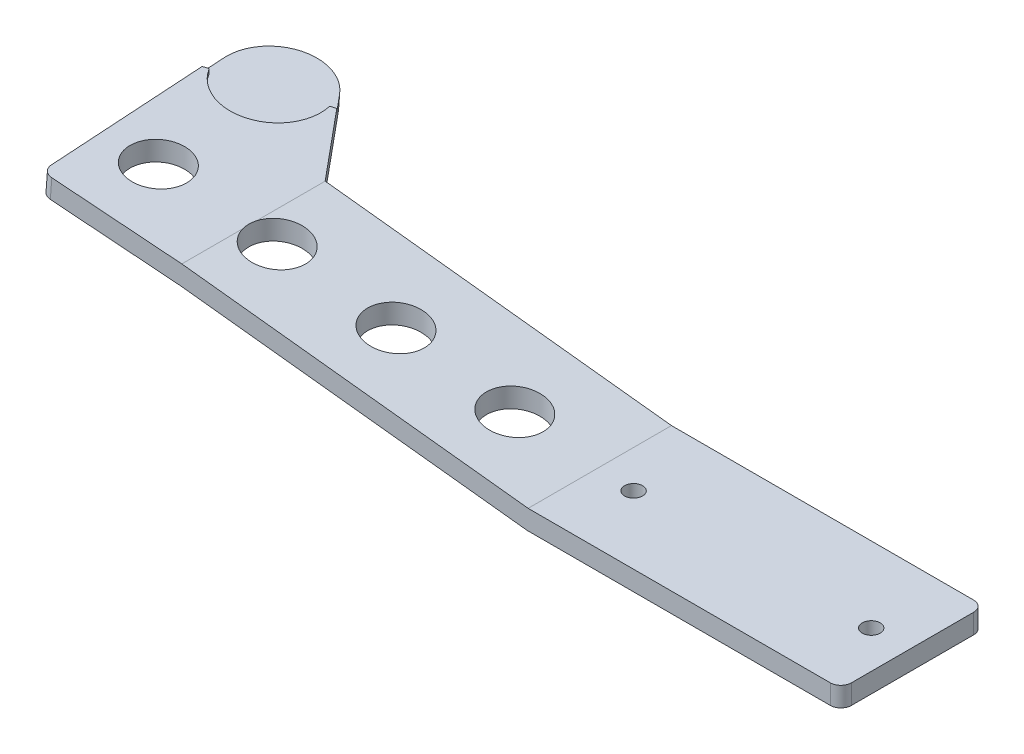
from build123d import *

# Parameters (mm, degrees)
BOSS_EXTRUDE1_DEPTH     = 24.13
CUT_EXTRUDE1_DEPTH      = 140.018460965
CUT_EXTRUDE1_DEPTH_BACK = 140.018460965
SKETCH2_R               = 1.5113
SKETCH2_R_2             = 4.7625
BOSS_EXTRUDE2_DEPTH     = 3.302
CUT_EXTRUDE2_DEPTH      = 140.247845391
CUT_EXTRUDE2_DEPTH_BACK = 140.247845391
FILLET1_R               = 1.778
CUT_EXTRUDE3_DEPTH      = 0.889


with BuildPart() as part:
    # Sketch1 → Boss-Extrude1 (new body)
    with BuildSketch(Plane.XY):
        Polygon((0, 0), (-52.832, 0), (-111.252, 6.498782895), (-136.652, 8.382), (-136.407851909, 11.674961541), (-110.947287613, 9.787254053), (-52.648903452, 3.302), (0, 3.302), align=None)
    extrude(amount=BOSS_EXTRUDE1_DEPTH)

    # Sketch2 → Cut-Extrude1 (cut, two sides: drawn at the far end of the back side and taken through both)
    with BuildSketch(Plane(origin=(0, 3.302, 0), x_dir=(1, 0, 0), z_dir=(0, 1, 0)).offset(-CUT_EXTRUDE1_DEPTH_BACK)):
        with Locations(Location((-6.324451726, -12.7, 0), (0, 0, 180))):
            Circle(SKETCH2_R)
        with Locations(Location((-46.324451726, -12.7, 0), (0, 0, 180))):
            Circle(SKETCH2_R)
        with Locations(Location((-66.324451726, -12.7, 0), (0, 0, 180))):
            Circle(SKETCH2_R_2)
        with Locations(Location((-86.324451726, -12.7, 0), (0, 0, 180))):
            Circle(SKETCH2_R_2)
        with Locations(Location((-106.324451726, -12.7, 0), (0, 0, 180))):
            Circle(SKETCH2_R_2)
        with Locations(Location((-126.324451726, -12.7, 0), (0, 0, 180))):
            Circle(SKETCH2_R_2)
    extrude(amount=CUT_EXTRUDE1_DEPTH + CUT_EXTRUDE1_DEPTH_BACK, mode=Mode.SUBTRACT)

    # Sketch3 → Boss-Extrude2 (add)
    with BuildSketch(Plane(origin=(0.115129755, 1.552819246, 0), x_dir=(0.9972627319520296, -0.07393945806924965, 0), z_dir=(0.07393945806924965, 0.9972627319520296, 0))):
        with BuildLine():
            Line((-136.897707384, 0), (-136.897707384, 8.89))
            ThreePointArc((-136.897707384, 8.89), (-131.63888491, 16.361853382), (-122.830660339, 13.933070421))
            Line((-122.830660339, 13.933070421), (-111.367259408, 0))
            Line((-111.367259408, 0), (-136.897707384, 0))
        make_face()
    extrude(amount=-BOSS_EXTRUDE2_DEPTH)

    # Sketch4 → Cut-Extrude2 (cut, two sides: drawn at the far end of the back side and taken through both)
    with BuildSketch(Plane(origin=(0.115129755, 1.552819246, 0), x_dir=(0.9972627319520296, -0.07393945806924965, 0), z_dir=(0.07393945806924965, 0.9972627319520296, 0)).offset(-CUT_EXTRUDE2_DEPTH_BACK)):
        Polygon((-136.897707384, 8.89), (-134.992707384, -24.13), (-136.897707384, -24.13), (-138.802707384, -24.13), (-138.802707384, 8.89), align=None)
    extrude(amount=CUT_EXTRUDE2_DEPTH + CUT_EXTRUDE2_DEPTH_BACK, mode=Mode.SUBTRACT)

    # Fillet1
    fillet1_edges = [part.edges().sort_by_distance(p)[0] for p in [
        (0, 1.651, 0),
        (0, 1.651, 24.13),
        (-134.63014045, 9.887626103, 24.13),
    ]]
    fillet(fillet1_edges, radius=FILLET1_R)

    # Sketch5 → Cut-Extrude3 (cut)
    with BuildSketch(Plane(origin=(0.115129755, 1.552819246, 0), x_dir=(0.9972627319520296, -0.07393945806924965, 0), z_dir=(0.07393945806924965, 0.9972627319520296, 0))):
        with BuildLine():
            Line((-135.786917217, 4.840316171), (-136.644610097, 4.502980352))
            Line((-136.644610097, 4.502980352), (-136.88295075, 8.406219254))
            ThreePointArc((-136.88295075, 8.406219254), (-131.865445622, 16.27671084), (-122.830660339, 13.933070421))
            Line((-122.830660339, 13.933070421), (-120.346128436, 10.913272179))
            Line((-120.346128436, 10.913272179), (-121.203821316, 10.57593636))
            ThreePointArc((-121.203821316, 10.57593636), (-126.054969147, 1.50328916), (-135.786917217, 4.840316171))
        make_face()
    extrude(amount=-CUT_EXTRUDE3_DEPTH, mode=Mode.SUBTRACT)


solid = part.part
